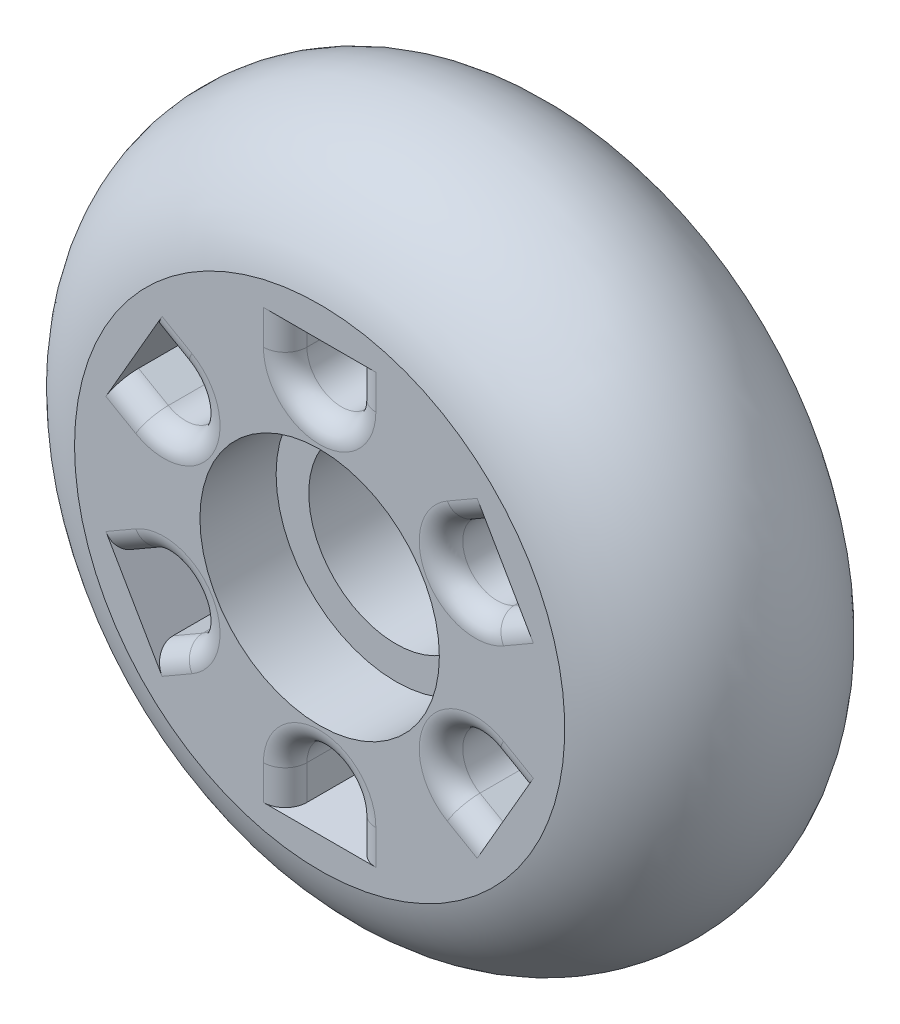
from build123d import *

# Parameters (mm, degrees)
SKETCH2_R          = 11
CUT_EXTRUDE1_DEPTH = 7
CUT_EXTRUDE2_START = -7
SKETCH3_R          = 11
CUT_EXTRUDE2_DEPTH = 7
CUT_EXTRUDE3_REACH = 50.343
SKETCH4_R          = 8
CUT_EXTRUDE4_REACH = 53.225
CIRPATTERN1_COUNT  = 6
FILLET1_R          = 2


with BuildPart() as part:
    # Sketch1 → Revolve1 (revolve)
    with BuildSketch(Plane(origin=(0, 0, 0), x_dir=(0, 0, -1), z_dir=(1, 0, 0)), mode=Mode.PRIVATE) as revolve1_sk:
        with BuildLine():
            Line((12, 0), (-12, 0))
            Line((-12, 0), (-12, 22.521190469))
            ThreePointArc((-12, 22.521190469), (0, 32), (12, 22.521190469))
            Line((12, 22.521190469), (12, 0))
        make_face()
    revolve(revolve1_sk.sketch.rotate(Axis((0, 0, -12), (0, 0, 1)), 90), axis=Axis((0, 0, -12), (0, 0, 1)))

    # Sketch2 → Cut-Extrude1 (cut)
    with BuildSketch(Plane.XY.offset(12)):
        Circle(SKETCH2_R)
    extrude(amount=-CUT_EXTRUDE1_DEPTH, mode=Mode.SUBTRACT)

    # Sketch3 → Cut-Extrude2 (cut)
    with BuildSketch(Plane(origin=(0, 0, -12), x_dir=(-1, 0, 0), z_dir=(0, 0, -1)).offset(CUT_EXTRUDE2_START)):
        with Locations(Location((0, 0, 0), (0, 0, 180))):
            Circle(SKETCH3_R)
    extrude(amount=CUT_EXTRUDE2_DEPTH, mode=Mode.SUBTRACT)

    # Sketch4 → Cut-Extrude3 (cut, up to next)
    with BuildSketch(Plane.XY.offset(5), mode=Mode.PRIVATE) as cut_extrude3_sk1:
        Circle(SKETCH4_R)
    cut_extrude3_tool1 = extrude(cut_extrude3_sk1.sketch, amount=-CUT_EXTRUDE3_REACH, mode=Mode.PRIVATE) & part.part
    add(cut_extrude3_tool1.solids().sort_by_distance((0, 0, 5))[0], mode=Mode.SUBTRACT)

    # Sketch6 → Cut-Extrude4 (cut, up to next)
    with BuildSketch(Plane.XY.offset(12), mode=Mode.PRIVATE) as cut_extrude4_sk1:
        with BuildLine():
            Line((-3.165625097, 16.530078933), (-3.165625097, 19.69570403))
            Line((-3.165625097, 19.69570403), (3.165625097, 19.69570403))
            Line((3.165625097, 19.69570403), (3.165625097, 16.530078933))
            ThreePointArc((3.165625097, 16.530078933), (0, 13.364453835), (-3.165625097, 16.530078933))
        make_face()
    cut_extrude4_tool1 = extrude(cut_extrude4_sk1.sketch, amount=-CUT_EXTRUDE4_REACH, mode=Mode.PRIVATE) & part.part
    cut_extrude4 = cut_extrude4_tool1.solids().sort_by_distance((0, 16.82559, 12))[0]
    add(cut_extrude4, mode=Mode.SUBTRACT)

    # CirPattern1: Cut-Extrude4 ×6 about axis
    cirpattern1_axis = Axis((0, 0, 0), (0, 0, 1))
    for i in range(1, CIRPATTERN1_COUNT):
        add(cut_extrude4.rotate(cirpattern1_axis, i * 360 / CIRPATTERN1_COUNT), mode=Mode.SUBTRACT)

    # Fillet1
    fillet1_edges = [part.edges().sort_by_distance(p)[0] for p in [
        (0, 13.364453835, -12),
        (-3.165625097, 18.112891481, -12),
        (3.165625097, 18.112891481, -12),
        (0, 13.364453835, 12),
        (3.165625097, 18.112891481, 12),
        (-3.165625097, 18.112891481, 12),
        (-11.573956529, 6.682226918, -12),
        (-17.269036707, 6.314933988, -12),
        (-14.10341161, 11.797957494, -12),
        (-11.573956529, 6.682226918, 12),
        (-14.10341161, 11.797957494, 12),
        (-17.269036707, 6.314933988, 12),
        (-11.573956529, -6.682226918, -12),
        (-14.10341161, -11.797957494, -12),
        (-17.269036707, -6.314933988, -12),
        (-11.573956529, -6.682226918, 12),
        (-17.269036707, -6.314933988, 12),
        (-14.10341161, -11.797957494, 12),
        (0, -13.364453835, -12),
        (3.165625097, -18.112891481, -12),
        (-3.165625097, -18.112891481, -12),
        (0, -13.364453835, 12),
        (-3.165625097, -18.112891481, 12),
        (3.165625097, -18.112891481, 12),
        (11.573956529, -6.682226918, -12),
        (17.269036707, -6.314933988, -12),
        (14.10341161, -11.797957494, -12),
        (11.573956529, -6.682226918, 12),
        (14.10341161, -11.797957494, 12),
        (17.269036707, -6.314933988, 12),
        (11.573956529, 6.682226918, -12),
        (14.10341161, 11.797957494, -12),
        (17.269036707, 6.314933988, -12),
        (11.573956529, 6.682226918, 12),
        (17.269036707, 6.314933988, 12),
        (14.10341161, 11.797957494, 12),
    ]]
    fillet(fillet1_edges, radius=FILLET1_R)


solid = part.part
